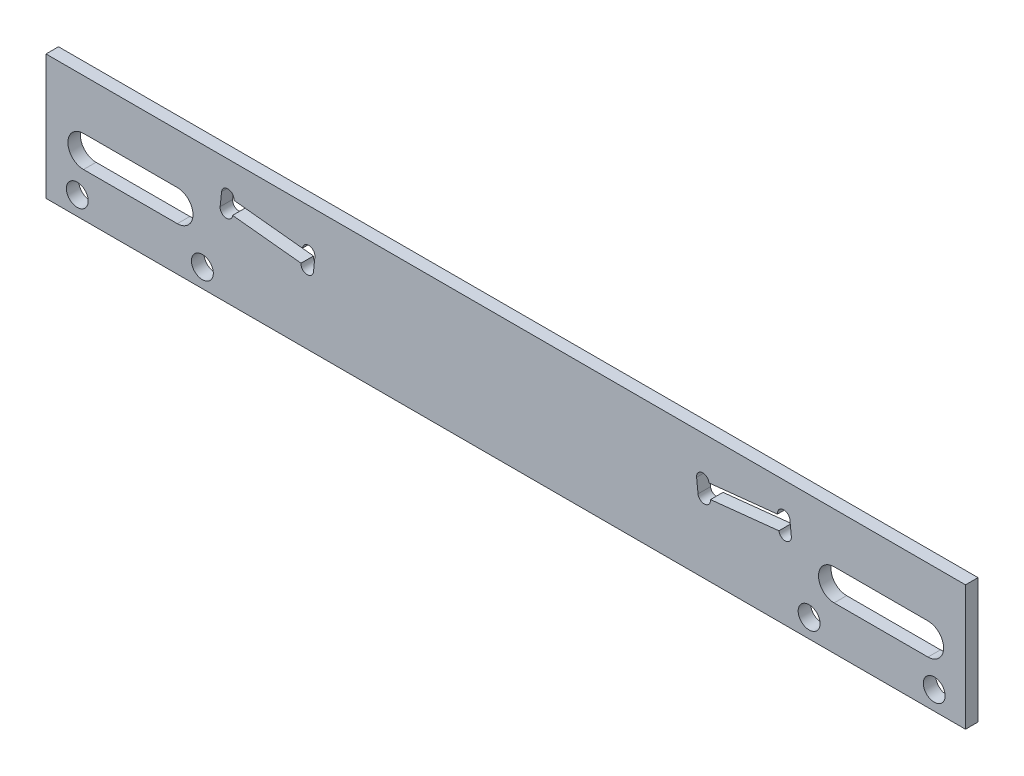
from build123d import *

# Parameters (mm, degrees)
SKETCH_1_W          = 147
SKETCH_1_H          = 20
EXTRUDE_1_DEPTH     = 2
CUT_EXTRUDE_1_DEPTH = 3
SKETCH_3_R          = 1
CUT_EXTRUDE_2_DEPTH = 75.204110398
SKETCH_4_R          = 1.75
CUT_EXTRUDE_3_DEPTH = 75.204110398
CUT_EXTRUDE_4_DEPTH = 75.204110398


with BuildPart() as part:
    # 草图1 → 凸台-拉伸1 (new body)
    with BuildSketch(Plane.XY):
        Rectangle(SKETCH_1_W, SKETCH_1_H)
    extrude(amount=EXTRUDE_1_DEPTH)

    # 草图2 → 切除-拉伸1 (cut)
    with BuildSketch(Plane.XY.offset(2)):
        Polygon((30.510902349, 3.396971992), (30.740864968, 1.209023822), (45.658693398, 2.776950771), (45.428730779, 4.964898941), align=None)
    cut_extrude_1 = extrude(amount=-CUT_EXTRUDE_1_DEPTH, mode=Mode.SUBTRACT)

    # 草图3 → 切除-拉伸2 (cut, through all)
    with BuildSketch(Plane.XY.offset(2)):
        with Locations((31.505424244, 3.501500455)):
            Circle(SKETCH_3_R)
        with Locations((31.735386863, 1.313552286)):
            Circle(SKETCH_3_R)
        with Locations((44.434208884, 4.860370478)):
            Circle(SKETCH_3_R)
        with Locations((44.664171503, 2.672422308)):
            Circle(SKETCH_3_R)
    cut_extrude_2 = extrude(amount=-CUT_EXTRUDE_2_DEPTH, mode=Mode.SUBTRACT)

    # 镜向1: 切除-拉伸1, 切除-拉伸2 across plane
    add(cut_extrude_1.mirror(Plane(origin=(0, 0, 0), x_dir=(0, 0, 1), z_dir=(1, 0, 0))), mode=Mode.SUBTRACT)
    add(cut_extrude_2.mirror(Plane(origin=(0, 0, 0), x_dir=(0, 0, 1), z_dir=(1, 0, 0))), mode=Mode.SUBTRACT)

    # 草图4 → 切除-拉伸3 (cut, through all)
    with BuildSketch(Plane(origin=(0, 0, 0), x_dir=(-1, 0, 0), z_dir=(0, 0, -1))):
        with Locations((68.5, -7)):
            Circle(SKETCH_4_R)
        with Locations((48.5, -7)):
            Circle(SKETCH_4_R)
        with Locations((-48.5, -7)):
            Circle(SKETCH_4_R)
        with Locations((-68.5, -7)):
            Circle(SKETCH_4_R)
    extrude(amount=-CUT_EXTRUDE_3_DEPTH, mode=Mode.SUBTRACT)

    # 草图5 → 切除-拉伸4 (cut, through all)
    with BuildSketch(Plane.XY.offset(2)):
        with BuildLine():
            Line((52.5, 2), (67.5, 2))
            ThreePointArc((67.5, 2), (70, -0.5), (67.5, -3))
            Line((67.5, -3), (52.5, -3))
            ThreePointArc((52.5, -3), (50, -0.5), (52.5, 2))
        make_face()
    cut_extrude_4 = extrude(amount=-CUT_EXTRUDE_4_DEPTH, mode=Mode.SUBTRACT)

    # 镜向2: 切除-拉伸4 across plane
    add(cut_extrude_4.mirror(Plane(origin=(0, 0, 0), x_dir=(0, 0, 1), z_dir=(1, 0, 0))), mode=Mode.SUBTRACT)


solid = part.part
